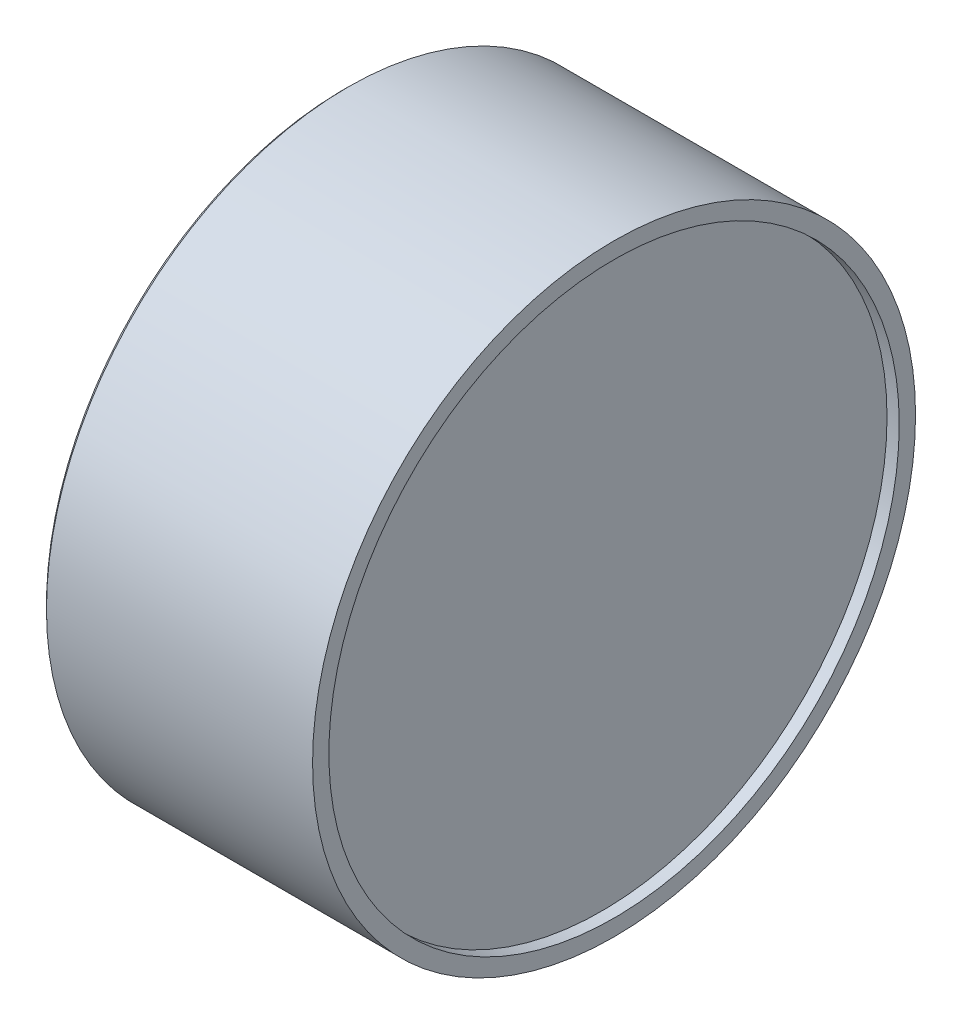
from build123d import *

# Parameters (mm, degrees)
SKETCH1_R                    = 37
BOSS_EXTRUDE1_DEPTH          = 16.83
SKETCH2_R                    = 1.25
CUT_EXTRUDE1_DEPTH           = 6.7
CHAMFER1_SIZE                = 0.5
CIRPATTERN1_COUNT            = 6
CHAMFER1_OF_CIRPATTERN1_SIZE = 0.5
SKETCH3_R                    = 28
CUT_EXTRUDE2_DEPTH           = 5.2
SKETCH4_R                    = 3.5
BOSS_EXTRUDE2_DEPTH          = 3.65
SKETCH5_R                    = 1.25
CUT_EXTRUDE3_DEPTH           = 5.15
CHAMFER2_SIZE                = 0.5
CHAMFER3_SIZE                = 0.5
SKETCH6_R                    = 35
CUT_EXTRUDE4_DEPTH           = 2
SKETCH7_R                    = 37
SKETCH7_R_2                  = 35
CUT_EXTRUDE5_DEPTH           = 0.5


with BuildPart() as part:
    # Sketch1 → Boss-Extrude1 (new, symmetric)
    with BuildSketch(Plane(origin=(0, 0, 0), x_dir=(0, 0, -1), z_dir=(1, 0, 0))):
        Circle(SKETCH1_R)
    extrude(amount=BOSS_EXTRUDE1_DEPTH, both=True)

    # Sketch2 → Cut-Extrude1 (cut)
    with BuildSketch(Plane.ZY.offset(16.83)):
        with Locations((0, 31.5)):
            Circle(SKETCH2_R)
    cut_extrude1 = extrude(amount=-CUT_EXTRUDE1_DEPTH, mode=Mode.SUBTRACT)

    # Chamfer1
    chamfer1_edges = [part.edges().sort_by_distance(p)[0] for p in [
        (-16.83, 31.5, -1.25),
    ]]
    chamfer(chamfer1_edges, length=CHAMFER1_SIZE)

    # CirPattern1: Cut-Extrude1 ×6 about axis
    cirpattern1_axis = Axis((0, 0, 0), (1, 0, 0))
    for i in range(1, CIRPATTERN1_COUNT):
        add(cut_extrude1.rotate(cirpattern1_axis, i * 360 / CIRPATTERN1_COUNT), mode=Mode.SUBTRACT)

    # Chamfer1 of CirPattern1
    chamfer1_of_cirpattern1_edges = [part.edges().sort_by_distance(p)[0] for p in [
        (-16.83, 16.832531755, 26.654800219),
        (-16.83, -14.667468245, 27.904800219),
        (-16.83, -31.5, 1.25),
        (-16.83, -16.832531755, -26.654800219),
        (-16.83, 14.667468245, -27.904800219),
    ]]
    chamfer(chamfer1_of_cirpattern1_edges, length=CHAMFER1_OF_CIRPATTERN1_SIZE)

    # Sketch3 → Cut-Extrude2 (cut)
    with BuildSketch(Plane.ZY.offset(16.83)):
        Circle(SKETCH3_R)
    extrude(amount=-CUT_EXTRUDE2_DEPTH, mode=Mode.SUBTRACT)

    # Sketch4 → Boss-Extrude2 (add)
    with BuildSketch(Plane.ZY.offset(11.63)):
        with Locations((15.5, 15.5)):
            Circle(SKETCH4_R)
        with Locations((-15.5, 15.5)):
            Circle(SKETCH4_R)
        with Locations((-15.5, -15.5)):
            Circle(SKETCH4_R)
        with Locations((15.5, -15.5)):
            Circle(SKETCH4_R)
    extrude(amount=BOSS_EXTRUDE2_DEPTH)

    # Sketch5 → Cut-Extrude3 (cut)
    with BuildSketch(Plane.ZY.offset(15.28)):
        with Locations((-15.5, 15.5)):
            Circle(SKETCH5_R)
        with Locations((15.5, 15.5)):
            Circle(SKETCH5_R)
        with Locations((15.5, -15.5)):
            Circle(SKETCH5_R)
        with Locations((-15.5, -15.5)):
            Circle(SKETCH5_R)
    extrude(amount=-CUT_EXTRUDE3_DEPTH, mode=Mode.SUBTRACT)

    # Chamfer2
    chamfer2_edges = [part.edges().sort_by_distance(p)[0] for p in [
        (-16.83, 0, 37),
        (-16.83, 0, -28),
    ]]
    chamfer(chamfer2_edges, length=CHAMFER2_SIZE)

    # Chamfer3
    chamfer3_edges = [part.edges().sort_by_distance(p)[0] for p in [
        (-15.28, -15.5, -16.75),
        (-15.28, -15.5, 14.25),
        (-15.28, 15.5, 14.25),
        (-15.28, 15.5, -16.75),
    ]]
    chamfer(chamfer3_edges, length=CHAMFER3_SIZE)

    # Sketch6 → Cut-Extrude4 (cut)
    with BuildSketch(Plane(origin=(16.83, 0, 0), x_dir=(0, 0, -1), z_dir=(1, 0, 0))):
        Circle(SKETCH6_R)
    extrude(amount=-CUT_EXTRUDE4_DEPTH, mode=Mode.SUBTRACT)

    # Sketch7 → Cut-Extrude5 (cut)
    with BuildSketch(Plane(origin=(16.83, 0, 0), x_dir=(0, 0, -1), z_dir=(1, 0, 0))):
        Circle(SKETCH7_R)
        Circle(SKETCH7_R_2, mode=Mode.SUBTRACT)
    extrude(amount=-CUT_EXTRUDE5_DEPTH, mode=Mode.SUBTRACT)


solid = part.part
